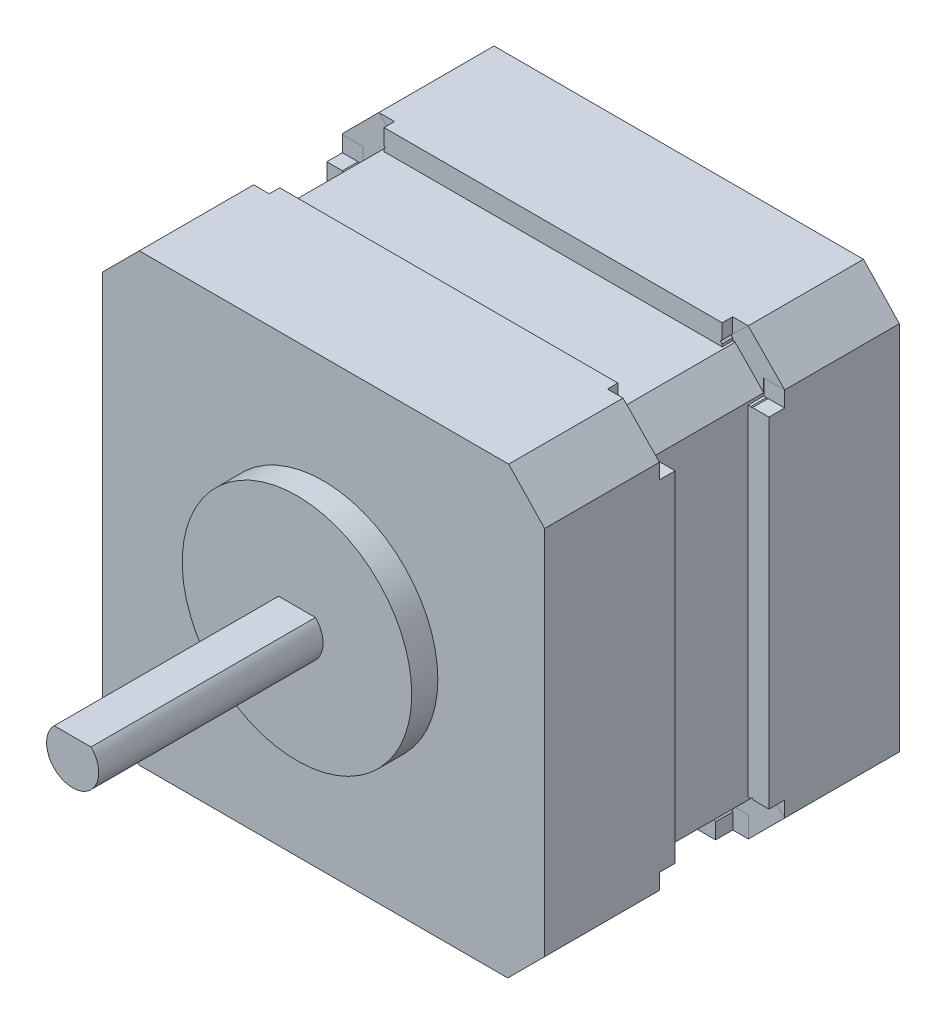
from build123d import *

# Parameters (mm, degrees)
BOSS_EXTRUDE1_DEPTH = 34
SKETCH2_R           = 11
BOSS_EXTRUDE2_DEPTH = 2.5
SKETCH3_R           = 2.5
BOSS_EXTRUDE3_DEPTH = 21.5
CUT_EXTRUDE3_DEPTH  = 2
CUT_EXTRUDE4_DEPTH  = 2
CUT_EXTRUDE5_DEPTH  = 2.3
CUT_EXTRUDE6_DEPTH  = 2.3
CUT_EXTRUDE7_DEPTH  = 2
CUT_EXTRUDE9_DEPTH  = 2
CUT_EXTRUDE10_DEPTH = 2.3
CUT_EXTRUDE11_DEPTH = 2.3
CUT_EXTRUDE12_START = -21.5
CUT_EXTRUDE12_DEPTH = 21.5


with BuildPart() as part:
    # Sketch1 → Boss-Extrude1 (new body)
    with BuildSketch(Plane.XY):
        Polygon((-17.614466094, 21.264089132), (-21.15, 17.728555226), (-21.15, -17.899022103), (-17.614466094, -21.434556009), (17.699167724, -21.434556009), (21.23470163, -17.899022103), (21.23470163, 17.639412218), (17.790617242, 21.264089132), align=None)
    extrude(amount=BOSS_EXTRUDE1_DEPTH)

    # Sketch2 → Boss-Extrude2 (add)
    with BuildSketch(Plane.XY.offset(34)):
        Circle(SKETCH2_R)
    extrude(amount=BOSS_EXTRUDE2_DEPTH)

    # Sketch3 → Boss-Extrude3 (add)
    with BuildSketch(Plane.XY.offset(36.5)):
        Circle(SKETCH3_R)
    extrude(amount=BOSS_EXTRUDE3_DEPTH)

    # Sketch7 → Cut-Extrude3 (cut)
    with BuildSketch(Plane(origin=(21.23470163, 0, 0), x_dir=(0, 0, -1), z_dir=(1, 0, 0))):
        Polygon((-22.997396737, 17.681766019), (-10.997396737, 17.639412218), (-10.997396737, 16.139412218), (-12.497396737, 16.139412218), (-12.497396737, -16.399022103), (-10.997396737, -16.399022103), (-10.997396737, -17.899022103), (-22.997396737, -17.899022103), (-22.997396737, -16.399022103), (-21.497396737, -16.399022103), (-21.497396737, 16.181766019), (-22.997396737, 16.181766019), align=None)
    extrude(amount=-CUT_EXTRUDE3_DEPTH, mode=Mode.SUBTRACT)

    # Sketch6 → Cut-Extrude4 (cut)
    with BuildSketch(Plane(origin=(0, 21.264089132, 0), x_dir=(1, 0, 0), z_dir=(0, 1, 0))):
        Polygon((-17.614466094, -11.039491966), (-17.614466094, -23.039491966), (-16.114466094, -23.039491966), (-16.114466094, -22.039491966), (16.290617242, -22.039491966), (16.290617242, -23.039491966), (17.790617242, -23.039491966), (17.790617242, -11.039491966), (16.290617242, -11.039491966), (16.290617242, -12.039491966), (-16.114466094, -12.039491966), (-16.114466094, -11.039491966), align=None)
    extrude(amount=-CUT_EXTRUDE4_DEPTH, mode=Mode.SUBTRACT)

    # Sketch8 → Cut-Extrude5 (cut)
    with BuildSketch(Plane(origin=(19.96770094, 18.97284881, 0), x_dir=(0, 0, -1), z_dir=(0.724935382761137, 0.6888168775668638, 0))):
        Polygon((-23.039491966, 3.160613175), (-22.997396737, -1.780962582), (-10.997396737, -1.839386825), (-11.039491966, 3.160613175), align=None)
    extrude(amount=-CUT_EXTRUDE5_DEPTH, mode=Mode.SUBTRACT)

    # Sketch10 → Cut-Extrude6 (cut)
    with BuildSketch(Plane(origin=(19.566861866, -19.566861866, 0), x_dir=(0, 0, -1), z_dir=(0.707106781186553, -0.7071067811865421, 0))):
        Polygon((-22.997396737, 2.358681613), (-22.932662916, -2.641318387), (-10.932662916, -2.641318387), (-10.997396737, 2.358681613), align=None)
    extrude(amount=-CUT_EXTRUDE6_DEPTH, mode=Mode.SUBTRACT)

    # Sketch9 → Cut-Extrude7 (cut)
    with BuildSketch(Plane.XZ.offset(21.434556009)):
        Polygon((17.699167724, 22.932662916), (17.699167724, 10.932662916), (16.199167724, 10.932662916), (16.199167724, 12.580798856), (-16.114466094, 12.580798856), (-16.114466094, 10.932662916), (-17.614466094, 10.932662916), (-17.614466094, 22.932662916), (-16.114466094, 22.932662916), (-16.114466094, 20.686804388), (16.199167724, 20.686804388), (16.199167724, 22.932662916), align=None)
    extrude(amount=-CUT_EXTRUDE7_DEPTH, mode=Mode.SUBTRACT)

    # Sketch13 → Cut-Extrude9 (cut)
    with BuildSketch(Plane.ZY.offset(21.15)):
        Polygon((22.997396737, 17.639412218), (10.997396737, 17.639412218), (10.997396737, 16.139412218), (12.497396737, 16.139412218), (12.497396737, -16.399022103), (10.997396737, -16.399022103), (10.997396737, -17.899022103), (22.997396737, -17.899022103), (22.997396737, -16.399022103), (21.497396737, -16.399022103), (21.497396737, 16.181766019), (22.997396737, 16.181766019), align=None)
    extrude(amount=-CUT_EXTRUDE9_DEPTH, mode=Mode.SUBTRACT)

    # Sketch14 → Cut-Extrude10 (cut)
    with BuildSketch(Plane(origin=(-19.439277613, 19.439277613, 0), x_dir=(0, 0, 1), z_dir=(-0.707106781186543, 0.7071067811865521, 0))):
        Polygon((11.039491966, 2.580673199), (10.997396737, -2.482360427), (22.997396737, -2.482360427), (23.039491966, 2.580673199), align=None)
    extrude(amount=-CUT_EXTRUDE10_DEPTH, mode=Mode.SUBTRACT)

    # Sketch15 → Cut-Extrude11 (cut)
    with BuildSketch(Plane(origin=(-19.524511051, -19.524511051, 0), x_dir=(0, 0, 1), z_dir=(-0.7071067811865381, -0.707106781186557, 0))):
        Polygon((10.997396737, 2.298788516), (10.932662916, -2.701211484), (22.932662916, -2.701211484), (22.997396737, 2.298788516), align=None)
    extrude(amount=-CUT_EXTRUDE11_DEPTH, mode=Mode.SUBTRACT)

    # Sketch16 → Cut-Extrude12 (cut)
    with BuildSketch(Plane.XY.offset(58).offset(CUT_EXTRUDE12_START)):
        with BuildLine():
            Line((-1.764671013, 1.770857481), (1.764671013, 1.770857481))
            ThreePointArc((1.764671013, 1.770857481), (0, 2.5), (-1.764671013, 1.770857481))
        make_face()
    extrude(amount=CUT_EXTRUDE12_DEPTH, mode=Mode.SUBTRACT)


solid = part.part
